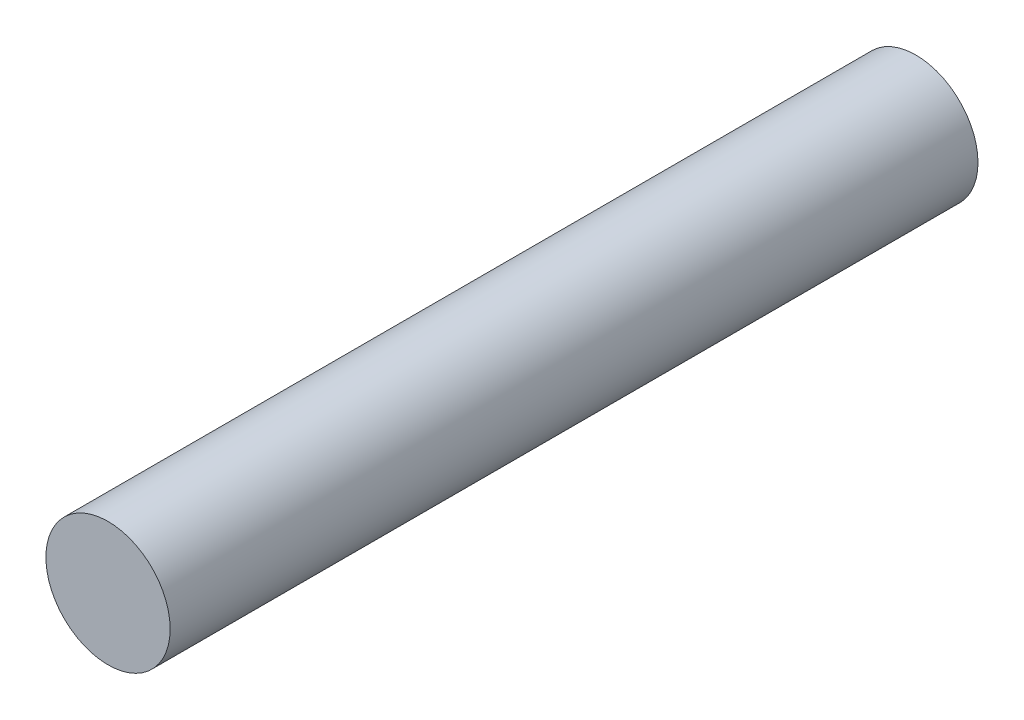
from build123d import *

# Parameters (mm, degrees)
SKETCH1_R           = 5
BOSS_EXTRUDE1_DEPTH = 65


with BuildPart() as part:
    # Sketch1 → Boss-Extrude1 (new body)
    with BuildSketch(Plane.XY):
        with Locations((-4.94089702, 5.722909497)):
            Circle(SKETCH1_R)
    extrude(amount=BOSS_EXTRUDE1_DEPTH)


solid = part.part
